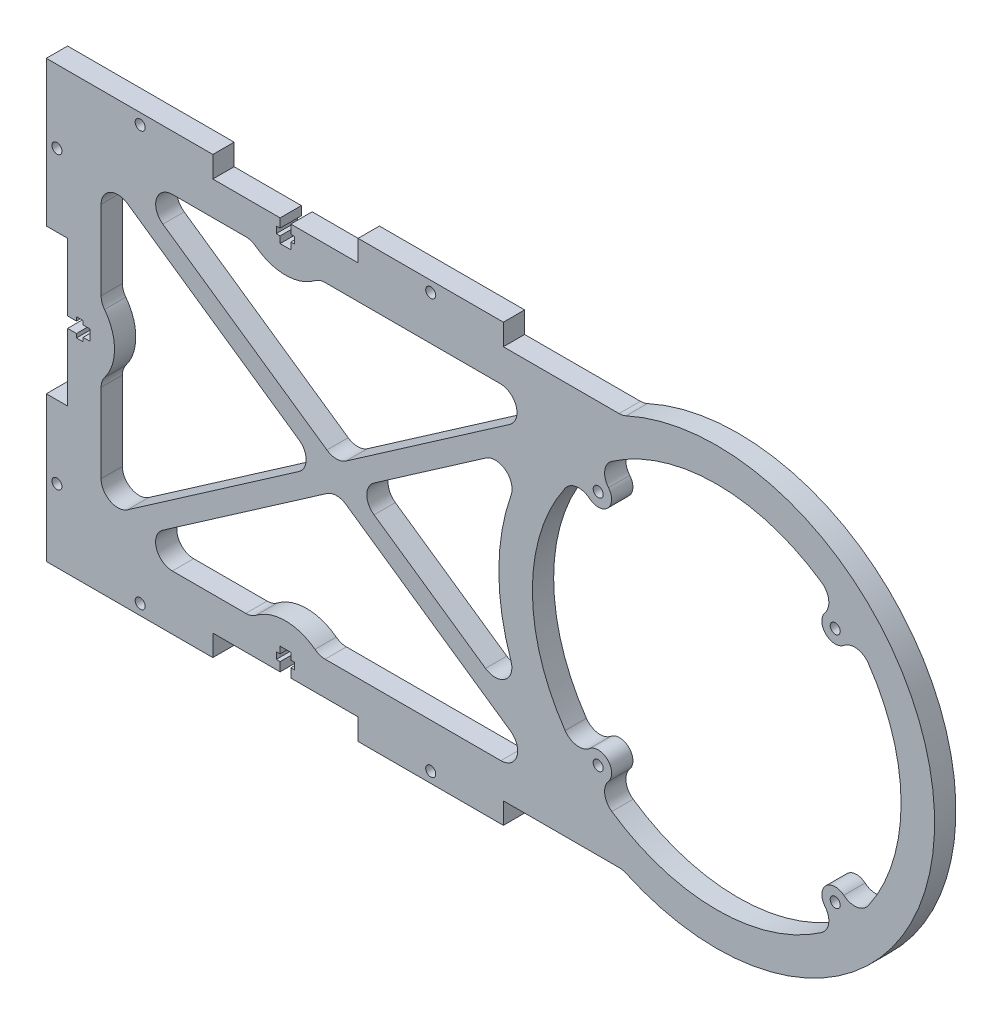
from build123d import *

# Parameters (mm, degrees)
SKETCH1_R           = 1.5
BOSS_EXTRUDE1_DEPTH = 6.35
FILLET1_R           = 5


with BuildPart() as part:
    # Sketch1 → Boss-Extrude1 (new body)
    with BuildSketch(Plane.XY):
        with BuildLine():
            Line((-28.021018897, 58.65), (-63.65, 58.65))
            Line((-63.65, 58.65), (-63.65, 65))
            Line((-63.65, 65), (-106.983333333, 65))
            Line((-106.983333333, 65), (-106.983333333, 58.65))
            Line((-106.983333333, 58.65), (-127.05, 58.65))
            Line((-127.05, 58.65), (-127.05, 56))
            Line((-127.05, 56), (-125.9, 56))
            Line((-125.9, 56), (-125.9, 54))
            Line((-125.9, 54), (-127.05, 54))
            Line((-127.05, 54), (-127.05, 52))
            Line((-127.05, 52), (-130.25, 52))
            Line((-130.25, 52), (-130.25, 54))
            Line((-130.25, 54), (-131.4, 54))
            Line((-131.4, 54), (-131.4, 56))
            Line((-131.4, 56), (-130.25, 56))
            Line((-130.25, 56), (-130.25, 58.65))
            Line((-130.25, 58.65), (-150.316666667, 58.65))
            Line((-150.316666667, 58.65), (-150.316666667, 65))
            Line((-150.316666667, 65), (-200, 65))
            Line((-200, 65), (-200, 21.666666667))
            Line((-200, 21.666666667), (-193.65, 21.666666667))
            Line((-193.65, 21.666666667), (-193.65, 1.6))
            Line((-193.65, 1.6), (-191, 1.6))
            Line((-191, 1.6), (-191, 2.75))
            Line((-191, 2.75), (-189, 2.75))
            Line((-189, 2.75), (-189, 1.6))
            Line((-189, 1.6), (-187, 1.6))
            Line((-187, 1.6), (-187, -1.6))
            Line((-187, -1.6), (-189, -1.6))
            Line((-189, -1.6), (-189, -2.75))
            Line((-189, -2.75), (-191, -2.75))
            Line((-191, -2.75), (-191, -1.6))
            Line((-191, -1.6), (-193.65, -1.6))
            Line((-193.65, -1.6), (-193.65, -21.666666667))
            Line((-193.65, -21.666666667), (-200, -21.666666667))
            Line((-200, -21.666666667), (-200, -65))
            Line((-200, -65), (-150.316666667, -65))
            Line((-150.316666667, -65), (-150.316666667, -58.65))
            Line((-150.316666667, -58.65), (-130.25, -58.65))
            Line((-130.25, -58.65), (-130.25, -56))
            Line((-130.25, -56), (-131.4, -56))
            Line((-131.4, -56), (-131.4, -54))
            Line((-131.4, -54), (-130.25, -54))
            Line((-130.25, -54), (-130.25, -52))
            Line((-130.25, -52), (-127.05, -52))
            Line((-127.05, -52), (-127.05, -54))
            Line((-127.05, -54), (-125.9, -54))
            Line((-125.9, -54), (-125.9, -56))
            Line((-125.9, -56), (-127.05, -56))
            Line((-127.05, -56), (-127.05, -58.65))
            Line((-127.05, -58.65), (-106.983333333, -58.65))
            Line((-106.983333333, -58.65), (-106.983333333, -65))
            Line((-106.983333333, -65), (-63.65, -65))
            Line((-63.65, -65), (-63.65, -58.65))
            Line((-63.65, -58.65), (-28.021018897, -58.65))
            ThreePointArc((-28.021018897, -58.65), (65, 0), (-28.021018897, 58.65))
        make_face()
        with Locations((-171.983333333, -61.825)):
            Circle(SKETCH1_R, mode=Mode.SUBTRACT)
        with Locations((-196.825, -43.333333333)):
            Circle(SKETCH1_R, mode=Mode.SUBTRACT)
        with Locations((-85.316666667, -61.825)):
            Circle(SKETCH1_R, mode=Mode.SUBTRACT)
        with BuildLine():
            Line((-113.434281063, -3.610028278), (-48.377019744, -48.65))
            Line((-48.377019744, -48.65), (-118.65, -48.65))
            ThreePointArc((-118.65, -48.65), (-128.65, -44.65), (-138.65, -48.65))
            Line((-138.65, -48.65), (-178.385375849, -48.65))
            Line((-178.385375849, -48.65), (-113.434281063, -3.610028278))
        make_face(mode=Mode.SUBTRACT)
        with Locations((-35.355339059, -35.355339059)):
            Circle(SKETCH1_R, mode=Mode.SUBTRACT)
        with Locations((35.355339059, -35.355339059)):
            Circle(SKETCH1_R, mode=Mode.SUBTRACT)
        with BuildLine():
            Line((-183.65, -44.999275964), (-183.65, -10))
            ThreePointArc((-183.65, -10), (-179.65, 0), (-183.65, 10))
            Line((-183.65, 10), (-183.65, 45.001209442))
            Line((-183.65, 45.001209442), (-118.703204375, 0.037714529))
            Line((-118.703204375, 0.037714529), (-183.65, -44.999275964))
        make_face(mode=Mode.SUBTRACT)
        with BuildLine():
            Line((-52.239853122, -38.678130071), (-108.168148251, 0.041741931))
            Line((-108.168148251, 0.041741931), (-52.013697044, 38.98173059))
            ThreePointArc((-52.013697044, 38.98173059), (-64.999724384, 0.189288039), (-52.239853122, -38.678130071))
        make_face(mode=Mode.SUBTRACT)
        with BuildLine():
            Line((-48.600559087, 48.65), (-113.437071563, 3.689484737))
            Line((-113.437071563, 3.689484737), (-178.37956328, 48.65))
            Line((-178.37956328, 48.65), (-138.65, 48.65))
            ThreePointArc((-138.65, 48.65), (-128.65, 44.65), (-118.65, 48.65))
            Line((-118.65, 48.65), (-48.600559087, 48.65))
        make_face(mode=Mode.SUBTRACT)
        with Locations((-171.983333333, 61.825)):
            Circle(SKETCH1_R, mode=Mode.SUBTRACT)
        with Locations((-85.316666667, 61.825)):
            Circle(SKETCH1_R, mode=Mode.SUBTRACT)
        with BuildLine():
            ThreePointArc((-41.616311831, -35.959457582), (-55, 0), (-41.616311831, 35.959457582))
            Line((-41.616311831, 35.959457582), (-38.183766184, 32.526911935))
            ThreePointArc((-38.183766184, 32.526911935), (-32.526911935, 32.526911935), (-32.526911935, 38.183766184))
            Line((-32.526911935, 38.183766184), (-35.959457582, 41.616311831))
            ThreePointArc((-35.959457582, 41.616311831), (0, 55), (35.959457582, 41.616311831))
            Line((35.959457582, 41.616311831), (32.526911935, 38.183766184))
            ThreePointArc((32.526911935, 38.183766184), (32.526911935, 32.526911935), (38.183766184, 32.526911935))
            Line((38.183766184, 32.526911935), (41.616311831, 35.959457582))
            ThreePointArc((41.616311831, 35.959457582), (55, 0), (41.616311831, -35.959457582))
            Line((41.616311831, -35.959457582), (38.183766184, -32.526911935))
            ThreePointArc((38.183766184, -32.526911935), (32.526911935, -32.526911935), (32.526911935, -38.183766184))
            Line((32.526911935, -38.183766184), (35.959457582, -41.616311831))
            ThreePointArc((35.959457582, -41.616311831), (0, -55), (-35.959457582, -41.616311831))
            Line((-35.959457582, -41.616311831), (-32.526911935, -38.183766184))
            ThreePointArc((-32.526911935, -38.183766184), (-32.526911935, -32.526911935), (-38.183766184, -32.526911935))
            Line((-38.183766184, -32.526911935), (-41.616311831, -35.959457582))
        make_face(mode=Mode.SUBTRACT)
        with Locations((-35.355339059, 35.355339059)):
            Circle(SKETCH1_R, mode=Mode.SUBTRACT)
        with Locations((35.355339059, 35.355339059)):
            Circle(SKETCH1_R, mode=Mode.SUBTRACT)
        with Locations((-196.825, 43.333333333)):
            Circle(SKETCH1_R, mode=Mode.SUBTRACT)
    extrude(amount=BOSS_EXTRUDE1_DEPTH)

    # Fillet1
    fillet1_edges = [part.edges().sort_by_distance(p)[0] for p in [
        (35.959457582, -41.616311831, 3.175),
        (35.959457582, 41.616311831, 3.175),
        (41.616311831, 35.959457582, 3.175),
        (-35.959457582, -41.616311831, 3.175),
        (-35.959457582, 41.616311831, 3.175),
        (41.616311831, -35.959457582, 3.175),
        (-41.616311831, -35.959457582, 3.175),
        (-41.616311831, 35.959457582, 3.175),
        (-108.168148251, 0.041741931, 3.175),
        (-118.703204375, 0.037714529, 3.175),
        (-113.434281063, -3.610028278, 3.175),
        (-113.437071563, 3.689484737, 3.175),
        (-183.65, -44.999275964, 3.175),
        (-178.385375849, -48.65, 3.175),
        (-48.377019744, -48.65, 3.175),
        (-52.239853122, -38.678130071, 3.175),
        (-52.013697044, 38.98173059, 3.175),
        (-48.600559087, 48.65, 3.175),
        (-178.37956328, 48.65, 3.175),
        (-183.65, 45.001209442, 3.175),
        (-118.65, 48.65, 3.175),
        (-138.65, 48.65, 3.175),
        (-138.65, -48.65, 3.175),
        (-118.65, -48.65, 3.175),
        (-183.65, 10, 3.175),
        (-183.65, -10, 3.175),
        (-28.021018897, 58.65, 3.175),
        (-28.021018897, -58.65, 3.175),
    ]]
    fillet(fillet1_edges, radius=FILLET1_R)


solid = part.part
